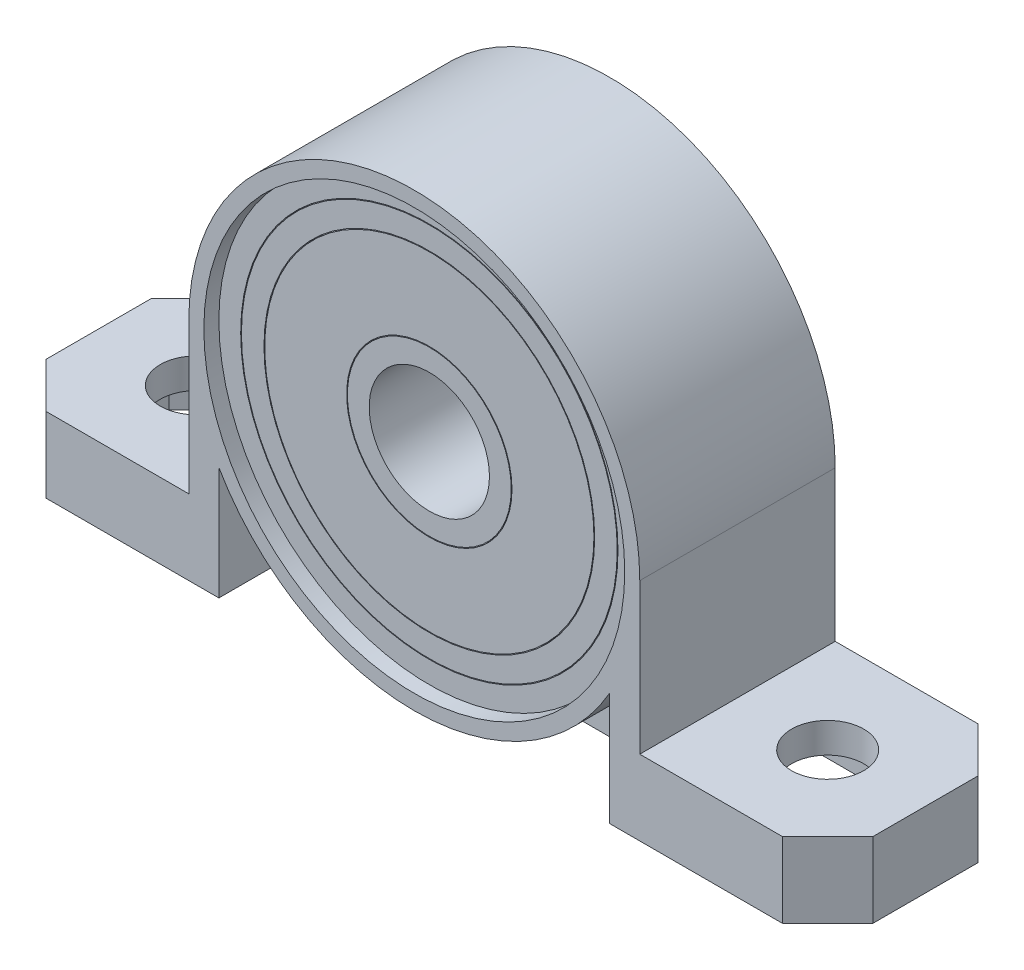
from build123d import *

# Parameters (mm, degrees)
BOSS_EXTRUDE1_DEPTH = 5
BOSS_EXTRUDE2_DEPTH = 13
CUT_EXTRUDE1_DEPTH  = 5
CUT_EXTRUDE2_START  = -5
CUT_EXTRUDE2_DEPTH  = 5
SKETCH5_R           = 2.4
CUT_EXTRUDE3_DEPTH  = 64.984373092
CUT_EXTRUDE4_DEPTH  = 3
SKETCH7_R           = 14
CUT_EXTRUDE5_DEPTH  = 1
CUT_EXTRUDE6_START  = -1
SKETCH8_R           = 14
CUT_EXTRUDE6_DEPTH  = 1
SKETCH9_R           = 4
CUT_EXTRUDE7_DEPTH  = 64.788713735
SKETCH10_R          = 12.55
SKETCH10_R_2        = 12.5
CUT_EXTRUDE8_DEPTH  = 0.5
SKETCH11_R          = 11
SKETCH11_R_2        = 10.95
CUT_EXTRUDE9_DEPTH  = 0.5
SKETCH12_R          = 5.5
SKETCH12_R_2        = 5.45
CUT_EXTRUDE10_DEPTH = 0.5
CUT_EXTRUDE11_START = -0.5
SKETCH13_R          = 5.5
SKETCH13_R_2        = 5.45
CUT_EXTRUDE11_DEPTH = 0.5
CUT_EXTRUDE12_START = -0.5
SKETCH14_R          = 12.55
SKETCH14_R_2        = 12.5
CUT_EXTRUDE12_DEPTH = 0.5
CUT_EXTRUDE13_START = -0.5
SKETCH15_R          = 11
SKETCH15_R_2        = 10.95
CUT_EXTRUDE13_DEPTH = 0.5


with BuildPart() as part:
    # Sketch1 → Boss-Extrude1 (new body)
    with BuildSketch(Plane(origin=(0, 0, 0), x_dir=(1, 0, 0), z_dir=(0, 1, 0))):
        Polygon((0, -3), (0, -10), (3, -13), (52, -13), (55, -10), (55, -3), (52, 0), (3, 0), align=None)
    extrude(amount=BOSS_EXTRUDE1_DEPTH)

    # Sketch2 → Boss-Extrude2 (add)
    with BuildSketch(Plane.XY.offset(13)):
        with BuildLine():
            Line((12.5, 15), (12.5, 0))
            Line((12.5, 0), (42.5, 0))
            Line((42.5, 0), (42.5, 15))
            ThreePointArc((42.5, 15), (27.5, 30), (12.5, 15))
        make_face()
    extrude(amount=-BOSS_EXTRUDE2_DEPTH)

    # Sketch3 → Cut-Extrude1 (cut)
    with BuildSketch(Plane.XY.offset(13)):
        with BuildLine():
            Line((14.5, 7.516685226), (14.5, 0))
            Line((14.5, 0), (14.5, -1))
            Line((14.5, -1), (40.5, -1))
            Line((40.5, -1), (40.5, 0))
            Line((40.5, 0), (40.5, 7.516685226))
            ThreePointArc((40.5, 7.516685226), (27.5, 0), (14.5, 7.516685226))
        make_face()
    extrude(amount=-CUT_EXTRUDE1_DEPTH, mode=Mode.SUBTRACT)

    # Sketch4 → Cut-Extrude2 (cut)
    with BuildSketch(Plane(origin=(0, 0, 0), x_dir=(-1, 0, 0), z_dir=(0, 0, -1)).offset(CUT_EXTRUDE2_START)):
        with BuildLine():
            Line((-40.5, 7.516685226), (-40.5, -2.151111231))
            Line((-40.5, -2.151111231), (-14.5, -2.151111231))
            Line((-14.5, -2.151111231), (-14.5, 7.516685226))
            ThreePointArc((-14.5, 7.516685226), (-27.5, 0), (-40.5, 7.516685226))
        make_face()
    extrude(amount=CUT_EXTRUDE2_DEPTH, mode=Mode.SUBTRACT)

    # Sketch5 → Cut-Extrude3 (cut, through all)
    with BuildSketch(Plane.XZ):
        with Locations(Location((6.5, 6.5, 0), (0, 0, 270))):
            Circle(SKETCH5_R)
        with Locations(Location((48.5, 6.5, 0), (0, 0, 90))):
            Circle(SKETCH5_R)
    extrude(amount=-CUT_EXTRUDE3_DEPTH, mode=Mode.SUBTRACT)

    # Sketch6 → Cut-Extrude4 (cut)
    with BuildSketch(Plane.XZ):
        Polygon((12.5, 2), (12.5, 11), (3.828427125, 11), (2, 9.171572875), (2, 3.828427125), (3.828427125, 2), align=None)
        Polygon((51.171572875, 2), (42.5, 2), (42.5, 11), (51.171572875, 11), (53, 9.171572875), (53, 3.828427125), align=None)
    extrude(amount=-CUT_EXTRUDE4_DEPTH, mode=Mode.SUBTRACT)

    # Sketch7 → Cut-Extrude5 (cut)
    with BuildSketch(Plane.XY.offset(13)):
        with Locations((27.5, 15)):
            Circle(SKETCH7_R)
    extrude(amount=-CUT_EXTRUDE5_DEPTH, mode=Mode.SUBTRACT)

    # Sketch8 → Cut-Extrude6 (cut)
    with BuildSketch(Plane(origin=(0, 0, 0), x_dir=(-1, 0, 0), z_dir=(0, 0, -1)).offset(CUT_EXTRUDE6_START)):
        with Locations(Location((-27.5, 15, 0), (0, 0, 180))):
            Circle(SKETCH8_R)
    extrude(amount=CUT_EXTRUDE6_DEPTH, mode=Mode.SUBTRACT)

    # Sketch9 → Cut-Extrude7 (cut, through all)
    with BuildSketch(Plane.XY.offset(12)):
        with Locations((27.5, 15)):
            Circle(SKETCH9_R)
    extrude(amount=-CUT_EXTRUDE7_DEPTH, mode=Mode.SUBTRACT)

    # Sketch10 → Cut-Extrude8 (cut)
    with BuildSketch(Plane.XY.offset(12)):
        with Locations((27.5, 15)):
            Circle(SKETCH10_R)
        with Locations((27.5, 15)):
            Circle(SKETCH10_R_2, mode=Mode.SUBTRACT)
    extrude(amount=-CUT_EXTRUDE8_DEPTH, mode=Mode.SUBTRACT)

    # Sketch11 → Cut-Extrude9 (cut)
    with BuildSketch(Plane.XY.offset(12)):
        with Locations((27.5, 15)):
            Circle(SKETCH11_R)
        with Locations((27.5, 15)):
            Circle(SKETCH11_R_2, mode=Mode.SUBTRACT)
    extrude(amount=-CUT_EXTRUDE9_DEPTH, mode=Mode.SUBTRACT)

    # Sketch12 → Cut-Extrude10 (cut)
    with BuildSketch(Plane.XY.offset(12)):
        with Locations((27.5, 15)):
            Circle(SKETCH12_R)
        with Locations((27.5, 15)):
            Circle(SKETCH12_R_2, mode=Mode.SUBTRACT)
    extrude(amount=-CUT_EXTRUDE10_DEPTH, mode=Mode.SUBTRACT)

    # Sketch13 → Cut-Extrude11 (cut)
    with BuildSketch(Plane(origin=(0, 0, 1), x_dir=(-1, 0, 0), z_dir=(0, 0, -1)).offset(CUT_EXTRUDE11_START)):
        with Locations(Location((-27.5, 15, 0), (0, 0, 180))):
            Circle(SKETCH13_R)
        with Locations(Location((-27.5, 15, 0), (0, 0, 180))):
            Circle(SKETCH13_R_2, mode=Mode.SUBTRACT)
    extrude(amount=CUT_EXTRUDE11_DEPTH, mode=Mode.SUBTRACT)

    # Sketch14 → Cut-Extrude12 (cut)
    with BuildSketch(Plane(origin=(0, 0, 1), x_dir=(-1, 0, 0), z_dir=(0, 0, -1)).offset(CUT_EXTRUDE12_START)):
        with Locations(Location((-27.5, 15, 0), (0, 0, 180))):
            Circle(SKETCH14_R)
        with Locations(Location((-27.5, 15, 0), (0, 0, 180))):
            Circle(SKETCH14_R_2, mode=Mode.SUBTRACT)
    extrude(amount=CUT_EXTRUDE12_DEPTH, mode=Mode.SUBTRACT)

    # Sketch15 → Cut-Extrude13 (cut)
    with BuildSketch(Plane(origin=(0, 0, 1), x_dir=(-1, 0, 0), z_dir=(0, 0, -1)).offset(CUT_EXTRUDE13_START)):
        with Locations(Location((-27.5, 15, 0), (0, 0, 180))):
            Circle(SKETCH15_R)
        with Locations(Location((-27.5, 15, 0), (0, 0, 180))):
            Circle(SKETCH15_R_2, mode=Mode.SUBTRACT)
    extrude(amount=CUT_EXTRUDE13_DEPTH, mode=Mode.SUBTRACT)


solid = part.part
